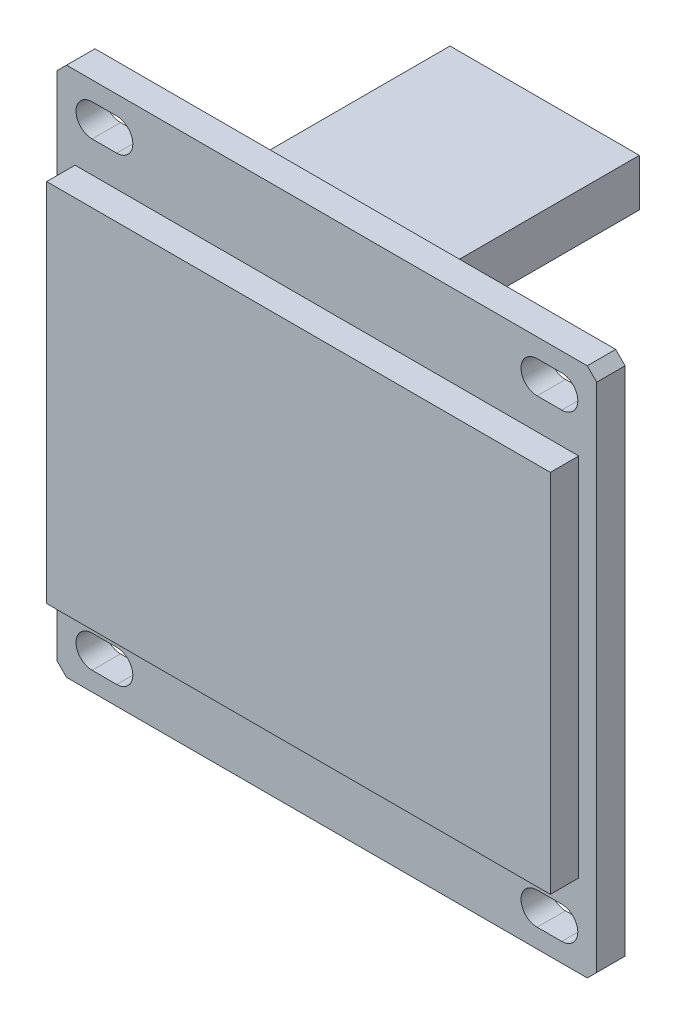
from build123d import *

# Parameters (mm, degrees)
EXTRUDE_1_DEPTH = 1.5
SKETCH_2_W      = 26.6
SKETCH_2_H      = 19.3
EXTRUDE_2_DEPTH = 1.5
SKETCH_3_W      = 10
SKETCH_3_H      = 2.5
EXTRUDE_3_DEPTH = 10


with BuildPart() as part:
    # 草圖1 → 填料-伸長1 (new body)
    with BuildSketch(Plane.XY):
        Polygon((-28.934480155, -35.507444045), (-1.434480155, -35.507444045), (-0.934480155, -36.007444045), (-0.934480155, -63.007444045), (-1.434480155, -63.507444045), (-28.934480155, -63.507444045), (-29.434480155, -63.007444045), (-29.434480155, -36.007444045), align=None)
        with BuildLine():
            Line((-4.084480155, -36.507444045), (-2.784480155, -36.507444045))
            ThreePointArc((-2.784480155, -36.507444045), (-1.934480155, -37.357444045), (-2.784480155, -38.207444045))
            Line((-2.784480155, -38.207444045), (-4.084480155, -38.207444045))
            ThreePointArc((-4.084480155, -38.207444045), (-4.934480155, -37.357444045), (-4.084480155, -36.507444045))
        make_face(mode=Mode.SUBTRACT)
        with BuildLine():
            Line((-27.584480155, -36.507444045), (-26.284480155, -36.507444045))
            ThreePointArc((-26.284480155, -36.507444045), (-25.434480155, -37.357444045), (-26.284480155, -38.207444045))
            Line((-26.284480155, -38.207444045), (-27.584480155, -38.207444045))
            ThreePointArc((-27.584480155, -38.207444045), (-28.434480155, -37.357444045), (-27.584480155, -36.507444045))
        make_face(mode=Mode.SUBTRACT)
        with BuildLine():
            Line((-27.584480155, -60.807444045), (-26.284480155, -60.807444045))
            ThreePointArc((-26.284480155, -60.807444045), (-25.434480155, -61.657444045), (-26.284480155, -62.507444045))
            Line((-26.284480155, -62.507444045), (-27.584480155, -62.507444045))
            ThreePointArc((-27.584480155, -62.507444045), (-28.434480155, -61.657444045), (-27.584480155, -60.807444045))
        make_face(mode=Mode.SUBTRACT)
        with BuildLine():
            Line((-4.084480155, -60.807444045), (-2.784480155, -60.807444045))
            ThreePointArc((-2.784480155, -60.807444045), (-1.934480155, -61.657444045), (-2.784480155, -62.507444045))
            Line((-2.784480155, -62.507444045), (-4.084480155, -62.507444045))
            ThreePointArc((-4.084480155, -62.507444045), (-4.934480155, -61.657444045), (-4.084480155, -60.807444045))
        make_face(mode=Mode.SUBTRACT)
    extrude(amount=EXTRUDE_1_DEPTH)

    # 草圖2 → 填料-伸長2 (add)
    with BuildSketch(Plane.XY.offset(1.5)):
        with Locations((-15.184480155, -49.507444045)):
            Rectangle(SKETCH_2_W, SKETCH_2_H)
    extrude(amount=EXTRUDE_2_DEPTH)

    # 草圖3 → 填料-伸長3 (add)
    with BuildSketch(Plane(origin=(0, 0, 0), x_dir=(-1, 0, 0), z_dir=(0, 0, -1))):
        with Locations((15.184480155, -37.257444045)):
            Rectangle(SKETCH_3_W, SKETCH_3_H)
    extrude(amount=EXTRUDE_3_DEPTH)


solid = part.part
